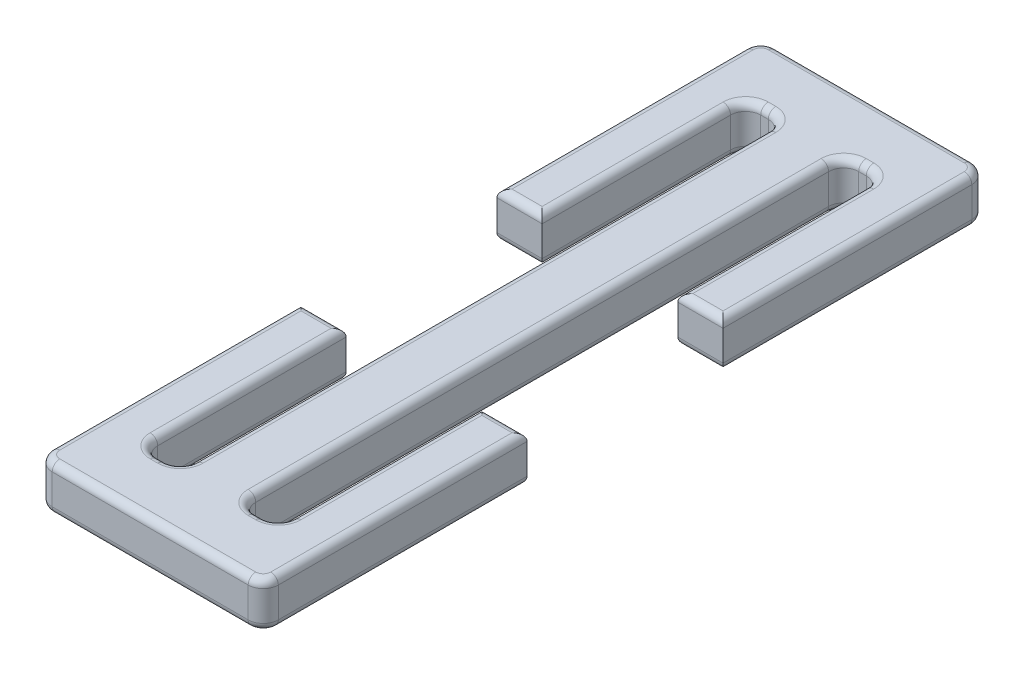
from build123d import *

# Parameters (mm, degrees)
SKETCH1_W           = 4
SKETCH1_H           = 40
BOSS_EXTRUDE1_DEPTH = 3
FILLET1_R           = 1
FILLET2_R           = 0.5


with BuildPart() as part:
    # Sketch1 → Boss-Extrude1 (new body)
    with BuildSketch(Plane(origin=(0, 0, 0), x_dir=(1, 0, 0), z_dir=(0, 1, 0))):
        Polygon((-7.5, 24), (-7.5, 6.5), (-4.5, 6.5), (-4.5, 20), (-2, 20), (2, 20), (4.5, 20), (4.5, 6.5), (7.5, 6.5), (7.5, 24), align=None)
        Polygon((-7.5, -6.5), (-7.5, -24), (7.5, -24), (7.5, -6.5), (4.5, -6.5), (4.5, -20), (2, -20), (-2, -20), (-4.5, -20), (-4.5, -6.5), align=None)
        Rectangle(SKETCH1_W, SKETCH1_H)
    extrude(amount=BOSS_EXTRUDE1_DEPTH)

    # Fillet1
    fillet1_edges = [part.edges().sort_by_distance(p)[0] for p in [
        (-7.5, 1.5, -24),
        (7.5, 1.5, -24),
        (4.5, 1.5, -20),
        (2, 1.5, -20),
        (2, 1.5, 20),
        (4.5, 1.5, 20),
        (7.5, 1.5, 24),
        (-7.5, 1.5, 24),
        (-4.5, 1.5, 20),
        (-2, 1.5, 20),
        (-2, 1.5, -20),
        (-4.5, 1.5, -20),
    ]]
    fillet(fillet1_edges, radius=FILLET1_R)

    # Fillet2
    fillet2_edges = [part.edges().sort_by_distance(p)[0] for p in [
        (-4.5, 3, -12.75),
        (-7.5, 3, -14.75),
        (-2.292893219, 0, 19.707106781),
        (-2.292893219, 3, 19.707106781),
        (-4.207106781, 0, 19.707106781),
        (-4.207106781, 3, 19.707106781),
        (-4.207106781, 0, -19.707106781),
        (-4.207106781, 3, -19.707106781),
        (2.292893219, 0, -19.707106781),
        (2.292893219, 3, -19.707106781),
        (-7.5, 0, -14.75),
        (7.5, 0, -14.75),
        (6, 0, -6.5),
        (4.5, 0, -12.75),
        (6, 0, 6.5),
        (-6, 0, 6.5),
        (-4.5, 0, -12.75),
        (-6, 0, -6.5),
        (-6, 3, 6.5),
        (-6, 3, -6.5),
        (6, 3, 6.5),
        (3.25, 0, -20),
        (3.25, 3, -20),
        (3.25, 0, 20),
        (3.25, 3, 20),
        (4.5, 0, 12.75),
        (4.5, 3, 12.75),
        (2, 0, 0),
        (2, 3, 0),
        (-2, 0, 0),
        (-2, 3, 0),
        (-3.25, 0, -20),
        (-3.25, 3, -20),
        (-3.25, 0, 20),
        (-3.25, 3, 20),
        (-4.5, 0, 12.75),
        (-4.5, 3, 12.75),
        (4.5, 3, -12.75),
        (0, 0, 24),
        (0, 3, 24),
        (0, 0, -24),
        (7.5, 0, 14.75),
        (-7.5, 0, 14.75),
        (7.207106781, 0, 23.707106781),
        (6, 3, -6.5),
        (7.207106781, 0, -23.707106781),
        (-7.207106781, 0, -23.707106781),
        (-7.207106781, 0, 23.707106781),
        (-7.5, 3, 14.75),
        (7.5, 3, 14.75),
        (0, 3, -24),
        (7.5, 3, -14.75),
        (7.207106781, 3, 23.707106781),
        (7.207106781, 3, -23.707106781),
        (-7.207106781, 3, -23.707106781),
        (-7.207106781, 3, 23.707106781),
        (4.207106781, 0, -19.707106781),
        (4.207106781, 3, -19.707106781),
        (4.207106781, 0, 19.707106781),
        (4.207106781, 3, 19.707106781),
        (2.292893219, 0, 19.707106781),
        (2.292893219, 3, 19.707106781),
        (-2.292893219, 0, -19.707106781),
        (-2.292893219, 3, -19.707106781),
    ]]
    fillet(fillet2_edges, radius=FILLET2_R)


solid = part.part
